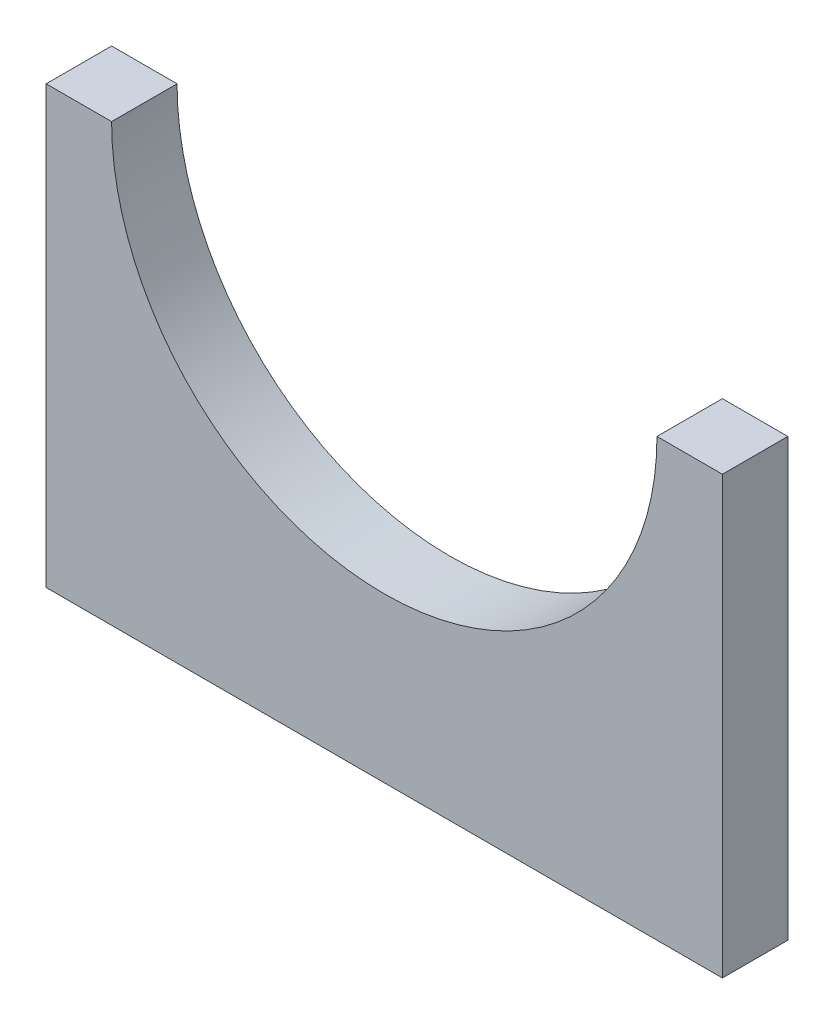
from build123d import *

# Parameters (mm, degrees)
BOSS_EXTRUDE1_DEPTH = 1.5


with BuildPart() as part:
    # Sketch1 → Boss-Extrude1 (new, symmetric)
    with BuildSketch(Plane.XY):
        with BuildLine():
            Line((-15.5, 0), (-12.5, 0))
            ThreePointArc((-12.5, 0), (0, -12.5), (12.5, 0))
            Line((12.5, 0), (15.5, 0))
            Line((15.5, 0), (15.5, -20))
            Line((15.5, -20), (-15.5, -20))
            Line((-15.5, -20), (-15.5, 0))
        make_face()
    extrude(amount=BOSS_EXTRUDE1_DEPTH, both=True)


solid = part.part
